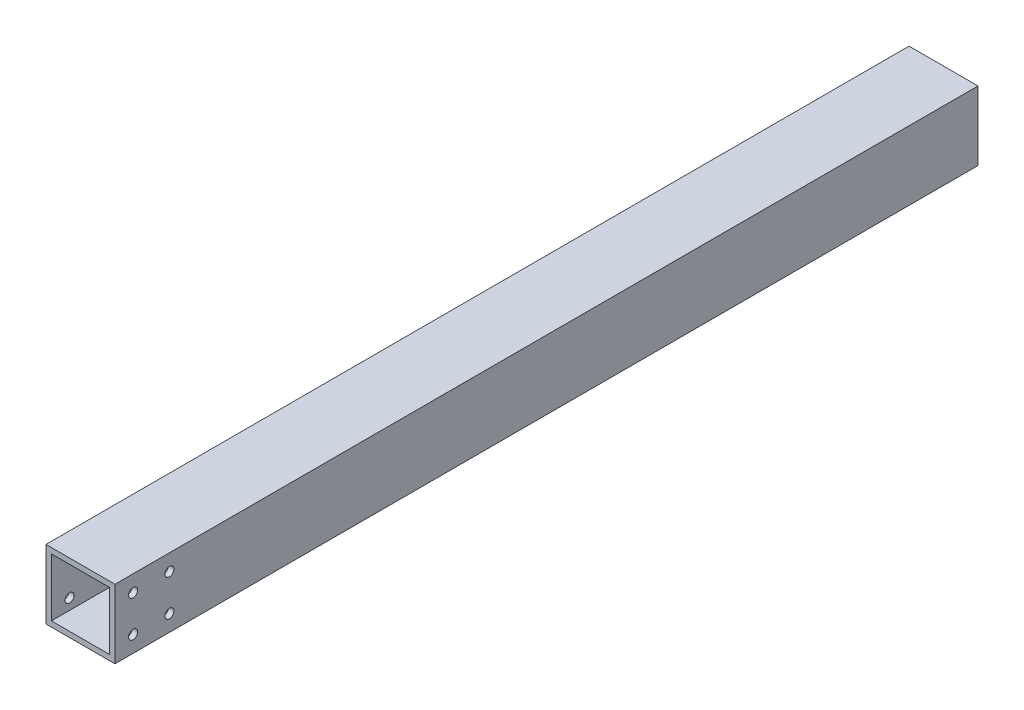
from build123d import *

# Parameters (mm, degrees)
SKETCH1_W               = 38
SKETCH1_H               = 38
SKETCH1_W_2             = 32
SKETCH1_H_2             = 32
BOSS_EXTRUDE1_DEPTH     = 475.6
CUT_EXTRUDE2_DEPTH      = 478.493832421
CUT_EXTRUDE2_DEPTH_BACK = 478.493832421
SKETCH3_R               = 2.5


with BuildPart() as part:
    # Sketch1 → Boss-Extrude1 (new body)
    with BuildSketch(Plane.XY):
        Rectangle(SKETCH1_W, SKETCH1_H)
        Rectangle(SKETCH1_W_2, SKETCH1_H_2, mode=Mode.SUBTRACT)
    extrude(amount=BOSS_EXTRUDE1_DEPTH)

    # Sketch3 → Cut-Extrude2 (cut, two sides: drawn at the far end of the back side and taken through both)
    with BuildSketch(Plane(origin=(19, 0, 0), x_dir=(0, 0, -1), z_dir=(1, 0, 0)).offset(-CUT_EXTRUDE2_DEPTH_BACK)):
        with Locations(Location((-465.6, 10, 0), (0, 0, 270))):
            Circle(SKETCH3_R)
        with Locations(Location((-445.6, 10, 0), (0, 0, 270))):
            Circle(SKETCH3_R)
        with Locations(Location((-445.6, -10, 0), (0, 0, 270))):
            Circle(SKETCH3_R)
        with Locations(Location((-465.6, -10, 0), (0, 0, 270))):
            Circle(SKETCH3_R)
    extrude(amount=CUT_EXTRUDE2_DEPTH + CUT_EXTRUDE2_DEPTH_BACK, mode=Mode.SUBTRACT)


solid = part.part
